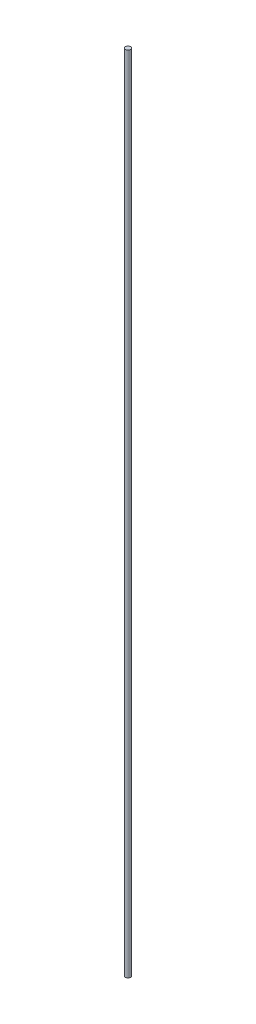
from build123d import *

# Parameters (mm, degrees)
SKETCH1_R           = 3.175
BOSS_EXTRUDE1_DEPTH = 500


with BuildPart() as part:
    # Sketch1 → Boss-Extrude1 (new, symmetric)
    with BuildSketch(Plane(origin=(0, 0, 0), x_dir=(1, 0, 0), z_dir=(0, 1, 0))):
        with Locations(Location((0, 0, 0), (0, 0, 270))):
            Circle(SKETCH1_R)
    extrude(amount=BOSS_EXTRUDE1_DEPTH, both=True)


solid = part.part
